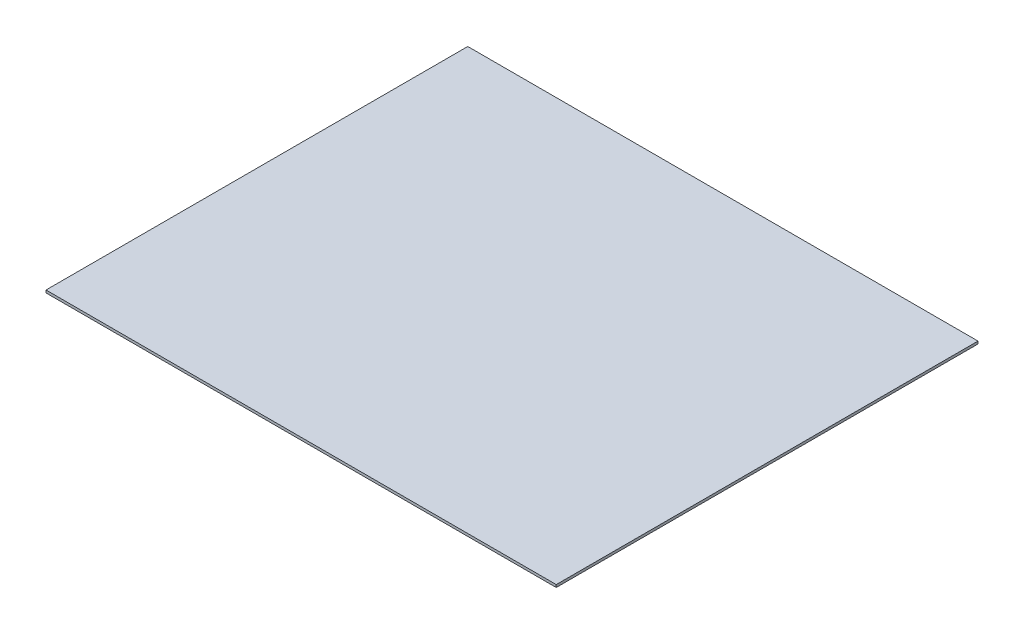
from build123d import *

# Parameters (mm, degrees)
SKETCH1_W           = 634.632732697
SKETCH1_H           = 524.58366
BOSS_EXTRUDE1_DEPTH = 3.175


with BuildPart() as part:
    # Sketch1 → Boss-Extrude1 (new body)
    with BuildSketch(Plane(origin=(0, 0, 0), x_dir=(1, 0, 0), z_dir=(0, 1, 0))):
        with Locations((38.836292013, 2.148025001)):
            Rectangle(SKETCH1_W, SKETCH1_H)
    extrude(amount=BOSS_EXTRUDE1_DEPTH)


solid = part.part
